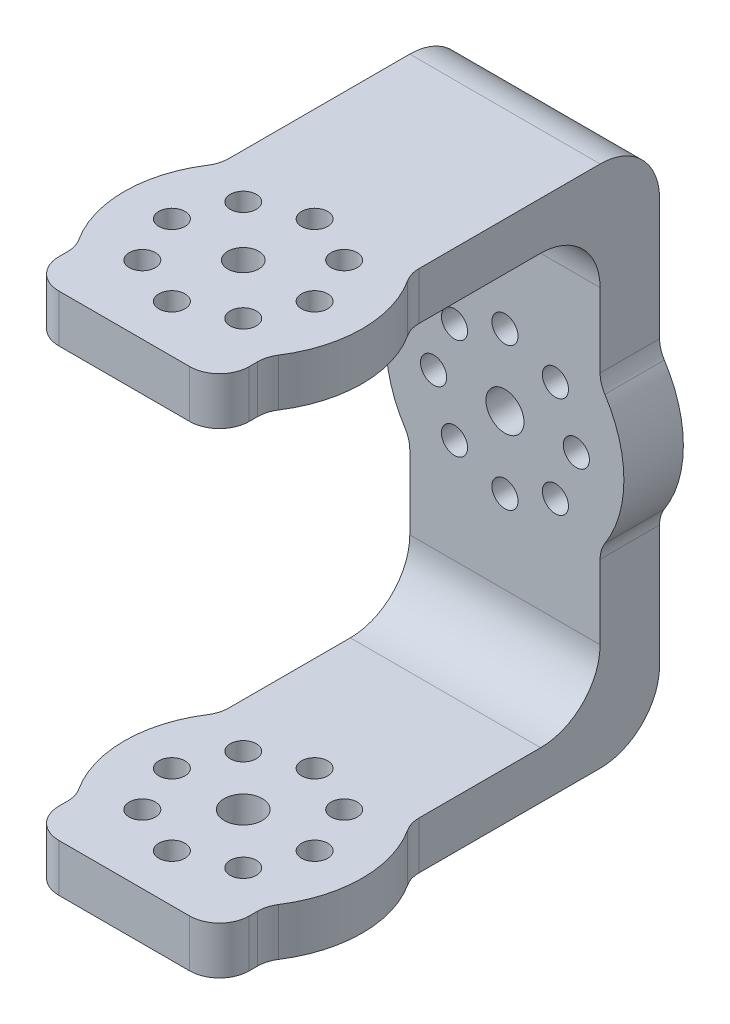
from build123d import *

# Parameters (mm, degrees)
SKETCH_1_R      = 1.6
SKETCH_1_R_2    = 1.1
EXTRUDE_1_DEPTH = 5
SKETCH_2_R      = 1.6
SKETCH_2_R_2    = 1.1
EXTRUDE_2_DEPTH = 4
EXTRUDE_START   = 4
SKETCH_3_R      = 1.1
SKETCH_3_R_2    = 1.3
EXTRUDE_3_DEPTH = 4
FILLET_1_R      = 5
FILLET_2_R      = 2.5


with BuildPart() as part:
    # ｽｹｯﾁ1 → ﾎﾞｽ - 押し出し1 (new body)
    with BuildSketch(Plane.XY):
        with BuildLine():
            Line((-8, 0), (8, 0))
            Line((8, 0), (8, 12))
            ThreePointArc((8, 12), (10, 18), (8, 24))
            Line((8, 24), (8, 36))
            Line((8, 36), (-8, 36))
            Line((-8, 36), (-8, 24))
            ThreePointArc((-8, 24), (-10, 18), (-8, 12))
            Line((-8, 12), (-8, 0))
        make_face()
        with Locations((0, 18)):
            Circle(SKETCH_1_R, mode=Mode.SUBTRACT)
        with Locations((0, 24)):
            Circle(SKETCH_1_R_2, mode=Mode.SUBTRACT)
        with Locations((4.242640687, 22.242640687)):
            Circle(SKETCH_1_R_2, mode=Mode.SUBTRACT)
        with Locations((6, 18)):
            Circle(SKETCH_1_R_2, mode=Mode.SUBTRACT)
        with Locations((4.242640687, 13.757359313)):
            Circle(SKETCH_1_R_2, mode=Mode.SUBTRACT)
        with Locations((0, 12)):
            Circle(SKETCH_1_R_2, mode=Mode.SUBTRACT)
        with Locations((-4.242640687, 13.757359313)):
            Circle(SKETCH_1_R_2, mode=Mode.SUBTRACT)
        with Locations((-6, 18)):
            Circle(SKETCH_1_R_2, mode=Mode.SUBTRACT)
        with Locations((-4.242640687, 22.242640687)):
            Circle(SKETCH_1_R_2, mode=Mode.SUBTRACT)
    extrude(amount=EXTRUDE_1_DEPTH)

    # ｽｹｯﾁ2 → ﾎﾞｽ - 押し出し2 (add)
    with BuildSketch(Plane.XZ):
        with BuildLine():
            Line((-8, 0), (8, 0))
            Line((8, 0), (8, 21))
            ThreePointArc((8, 21), (10, 27), (8, 33))
            Line((8, 33), (8, 37))
            Line((8, 37), (-8, 37))
            Line((-8, 37), (-8, 33))
            ThreePointArc((-8, 33), (-10, 27), (-8, 21))
            Line((-8, 21), (-8, 0))
        make_face()
        with Locations(Location((0, 27, 0), (0, 0, 270))):
            Circle(SKETCH_2_R, mode=Mode.SUBTRACT)
        with Locations(Location((6, 27, 0), (0, 0, 270))):
            Circle(SKETCH_2_R_2, mode=Mode.SUBTRACT)
        with Locations(Location((4.242640687, 22.757359313, 0), (0, 0, 270))):
            Circle(SKETCH_2_R_2, mode=Mode.SUBTRACT)
        with Locations(Location((0, 21, 0), (0, 0, 270))):
            Circle(SKETCH_2_R_2, mode=Mode.SUBTRACT)
        with Locations(Location((-4.242640687, 22.757359313, 0), (0, 0, 270))):
            Circle(SKETCH_2_R_2, mode=Mode.SUBTRACT)
        with Locations(Location((-6, 27, 0), (0, 0, 270))):
            Circle(SKETCH_2_R_2, mode=Mode.SUBTRACT)
        with Locations(Location((-4.242640687, 31.242640687, 0), (0, 0, 270))):
            Circle(SKETCH_2_R_2, mode=Mode.SUBTRACT)
        with Locations(Location((0, 33, 0), (0, 0, 270))):
            Circle(SKETCH_2_R_2, mode=Mode.SUBTRACT)
        with Locations(Location((4.242640687, 31.242640687, 0), (0, 0, 270))):
            Circle(SKETCH_2_R_2, mode=Mode.SUBTRACT)
    extrude(amount=EXTRUDE_2_DEPTH)

    # ｽｹｯﾁ3 → ﾎﾞｽ - 押し出し3 (add)
    with BuildSketch(Plane(origin=(0, 36, 0), x_dir=(1, 0, 0), z_dir=(0, 1, 0)).offset(EXTRUDE_START)):
        with BuildLine():
            Line((8, -5), (8, 0))
            Line((8, 0), (-8, 0))
            Line((-8, 0), (-8, -5))
            Line((-8, -5), (-8, -21))
            ThreePointArc((-8, -21), (-10, -27), (-8, -33))
            Line((-8, -33), (-8, -37))
            Line((-8, -37), (8, -37))
            Line((8, -37), (8, -33))
            ThreePointArc((8, -33), (10, -27), (8, -21))
            Line((8, -21), (8, -5))
        make_face()
        with Locations(Location((4.242640687, -22.757359313, 0), (0, 0, 90))):
            Circle(SKETCH_3_R, mode=Mode.SUBTRACT)
        with Locations(Location((0, -21, 0), (0, 0, 90))):
            Circle(SKETCH_3_R, mode=Mode.SUBTRACT)
        with Locations(Location((-4.242640687, -22.757359313, 0), (0, 0, 90))):
            Circle(SKETCH_3_R, mode=Mode.SUBTRACT)
        with Locations(Location((-6, -27, 0), (0, 0, 90))):
            Circle(SKETCH_3_R, mode=Mode.SUBTRACT)
        with Locations(Location((-4.242640687, -31.242640687, 0), (0, 0, 90))):
            Circle(SKETCH_3_R, mode=Mode.SUBTRACT)
        with Locations(Location((0, -33, 0), (0, 0, 90))):
            Circle(SKETCH_3_R, mode=Mode.SUBTRACT)
        with Locations(Location((4.242640687, -31.242640687, 0), (0, 0, 90))):
            Circle(SKETCH_3_R, mode=Mode.SUBTRACT)
        with Locations(Location((6, -27, 0), (0, 0, 90))):
            Circle(SKETCH_3_R, mode=Mode.SUBTRACT)
        with Locations(Location((0, -27, 0), (0, 0, 270))):
            Circle(SKETCH_3_R_2, mode=Mode.SUBTRACT)
    extrude(amount=-EXTRUDE_3_DEPTH)

    # ﾌｨﾚｯﾄ1
    fillet_1_edges = [part.edges().sort_by_distance(p)[0] for p in [
        (0, 40, 0),
        (0, 36, 5),
        (0, -4, 0),
        (0, 0, 5),
    ]]
    fillet(fillet_1_edges, radius=FILLET_1_R)

    # ﾌｨﾚｯﾄ2
    fillet_2_edges = [part.edges().sort_by_distance(p)[0] for p in [
        (8, 38, 21),
        (-8, 38, 21),
        (-8, 38, 33),
        (-8, 38, 37),
        (8, 38, 37),
        (8, 38, 33),
        (-8, 12, 2.5),
        (-8, 24, 2.5),
        (8, 24, 2.5),
        (8, 12, 2.5),
        (-8, -2, 21),
        (8, -2, 21),
        (8, -2, 33),
        (8, -2, 37),
        (-8, -2, 37),
        (-8, -2, 33),
    ]]
    fillet(fillet_2_edges, radius=FILLET_2_R)


solid = part.part
